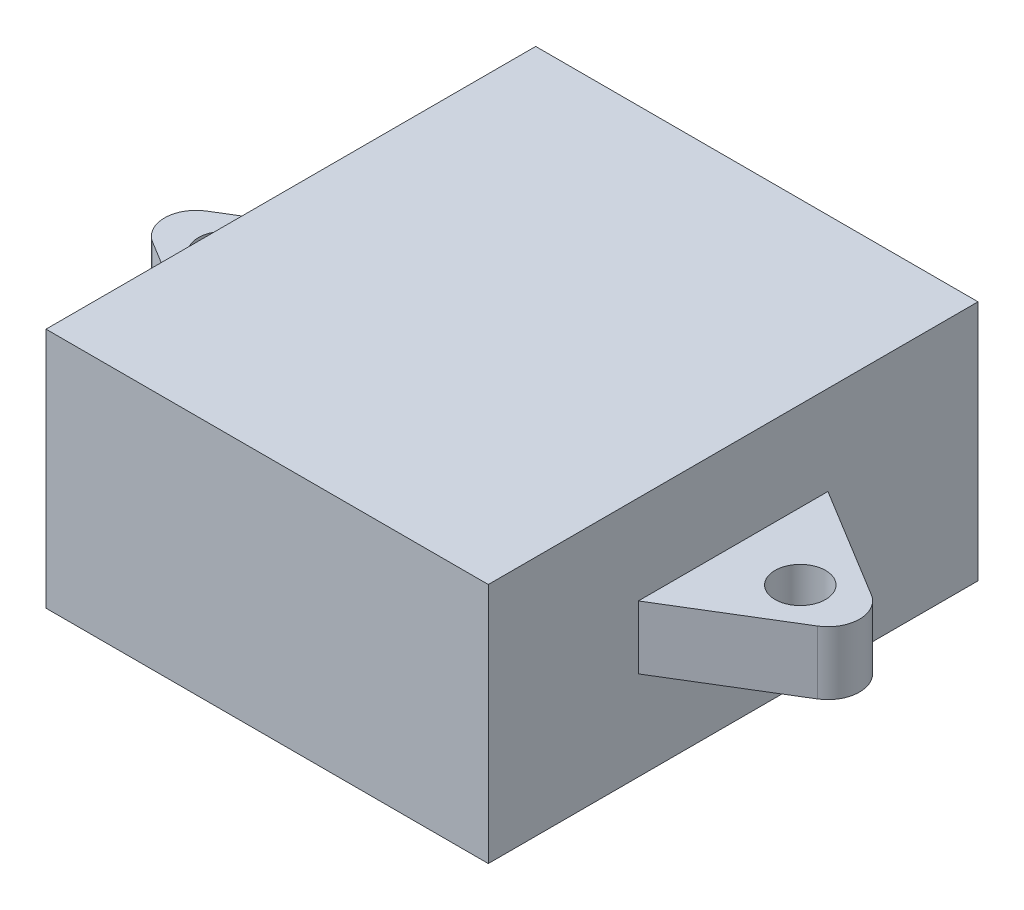
from build123d import *

# Parameters (mm, degrees)
SKETCH_1_W      = 28
SKETCH_1_H      = 31
EXTRUDE_1_DEPTH = 15.3
SKETCH_2_R      = 1.6
EXTRUDE_2_DEPTH = 2


with BuildPart() as part:
    # 草图1 → 凸台-拉伸1 (new body)
    with BuildSketch(Plane(origin=(0, 0, 0), x_dir=(1, 0, 0), z_dir=(0, 1, 0))):
        with Locations((0, -3.201657459)):
            Rectangle(SKETCH_1_W, SKETCH_1_H)
    extrude(amount=EXTRUDE_1_DEPTH)

    # 草图2 → 凸台-拉伸2 (add, symmetric)
    with BuildSketch(Plane(origin=(0, 7.65, 0), x_dir=(1, 0, 0), z_dir=(0, 1, 0))):
        with BuildLine():
            Line((14, 2.798342541), (21.041035209, -1.493955583))
            ThreePointArc((21.041035209, -1.493955583), (22, -3.201657459), (21.041035209, -4.909359334))
            Line((21.041035209, -4.909359334), (14, -9.201657459))
            Line((14, -9.201657459), (14, 2.798342541))
        make_face()
        with Locations(Location((18.25, -3.201657459, 0), (0, 0, 270))):
            Circle(SKETCH_2_R, mode=Mode.SUBTRACT)
    extrude_2 = extrude(amount=EXTRUDE_2_DEPTH, both=True)

    # 镜向1: 凸台-拉伸2 across plane
    add(extrude_2.mirror(Plane(origin=(0, 0, 0), x_dir=(0, 0, 1), z_dir=(1, 0, 0))))


solid = part.part
